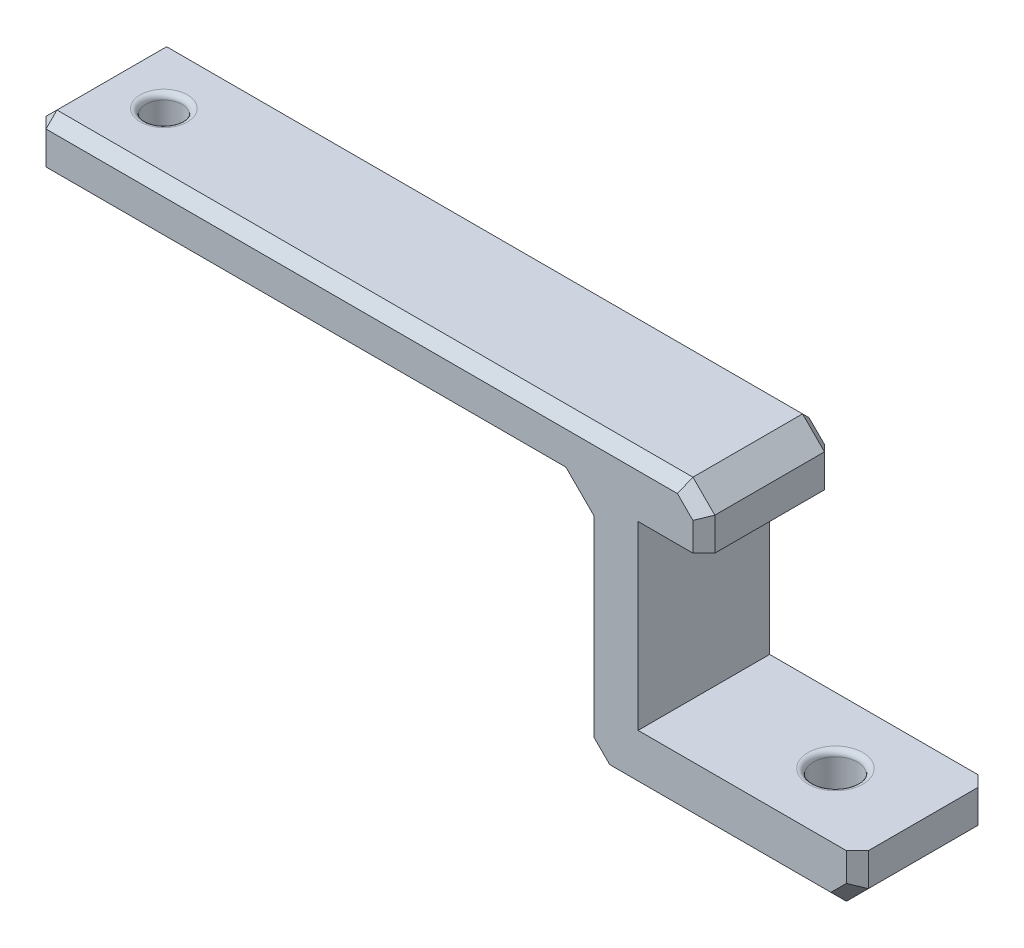
from build123d import *

# Parameters (mm, degrees)
RESSALTO_EXTRUS_O1_DEPTH = 12
ESBO_O3_R                = 2
CORTE_EXTRUS_O1_DEPTH    = 15
CHANFRO1_SIZE            = 1.5
FILETE1_R                = 0.5
CHANFRO5_SIZE            = 2
CHANFRO8_SIZE            = 1
ESBO_O4_R                = 1.65
CORTE_EXTRUS_O2_DEPTH    = 10
FILETE2_R                = 0.5


with BuildPart() as part:
    # Esboço1 → Ressalto-extrusão1 (new body)
    with BuildSketch(Plane.XY):
        Polygon((19.886382163, 14.25), (13.886382163, 14.25), (13.886382163, -2.25), (33.886382163, -2.25), (33.886382163, -7.25), (8.886382163, -7.25), (8.886382163, 14.25), (-41.113617837, 14.25), (-41.113617837, 19.25), (19.886382163, 19.25), align=None)
    extrude(amount=RESSALTO_EXTRUS_O1_DEPTH)

    # Esboço3 → Corte-extrusão1 (cut)
    with BuildSketch(Plane.XZ.offset(7.25)):
        with Locations(Location((25.886382163, 6, 0), (0, 0, 270))):
            Circle(ESBO_O3_R)
    extrude(amount=-CORTE_EXTRUS_O1_DEPTH, mode=Mode.SUBTRACT)

    # Chanfro1
    chanfro1_edges = [part.edges().sort_by_distance(p)[0] for p in [
        (25.886382163, -7.25, 8),
    ]]
    chamfer(chanfro1_edges, length=CHANFRO1_SIZE)

    # Filete1
    filete1_edges = [part.edges().sort_by_distance(p)[0] for p in [
        (25.886382163, -2.25, 8),
    ]]
    fillet(filete1_edges, radius=FILETE1_R)

    # Chanfro5
    chanfro5_edges = [part.edges().sort_by_distance(p)[0] for p in [
        (33.886382163, -7.25, 6),
        (8.886382163, -7.25, 6),
        (8.886382163, 14.25, 6),
        (19.886382163, 19.25, 6),
    ]]
    chamfer(chanfro5_edges, length=CHANFRO5_SIZE)

    # Chanfro8
    chanfro8_edges = [part.edges().sort_by_distance(p)[0] for p in [
        (-41.113617837, 19.25, 6),
        (-41.113617837, 16.75, 12),
        (-41.113617837, 14.25, 6),
        (-41.113617837, 16.75, 0),
        (19.886382163, 15.75, 0),
        (-11.613617837, 19.25, 0),
        (33.886382163, -3.75, 0),
        (32.886382163, -6.25, 0),
        (21.386382163, -7.25, 0),
        (9.886382163, -6.25, 0),
        (8.886382163, 3.5, 0),
        (7.886382163, 13.25, 0),
        (-17.113617837, 14.25, 0),
        (33.886382163, -3.75, 12),
        (32.886382163, -6.25, 12),
        (21.386382163, -7.25, 12),
        (9.886382163, -6.25, 12),
        (8.886382163, 3.5, 12),
        (7.886382163, 13.25, 12),
        (-17.113617837, 14.25, 12),
        (19.886382163, 15.75, 12),
        (-11.613617837, 19.25, 12),
        (18.886382163, 18.25, 0),
        (18.886382163, 18.25, 12),
    ]]
    chamfer(chanfro8_edges, length=CHANFRO8_SIZE)

    # Esboço4 → Corte-extrusão2 (cut)
    with BuildSketch(Plane(origin=(0, 19.25, 0), x_dir=(1, 0, 0), z_dir=(0, 1, 0))):
        with Locations(Location((-35.363617837, -6, 0), (0, 0, 270))):
            Circle(ESBO_O4_R)
    extrude(amount=-CORTE_EXTRUS_O2_DEPTH, mode=Mode.SUBTRACT)

    # Filete2
    filete2_edges = [part.edges().sort_by_distance(p)[0] for p in [
        (-35.363617837, 14.25, 4.35),
        (-35.363617837, 19.25, 4.35),
    ]]
    fillet(filete2_edges, radius=FILETE2_R)


solid = part.part
